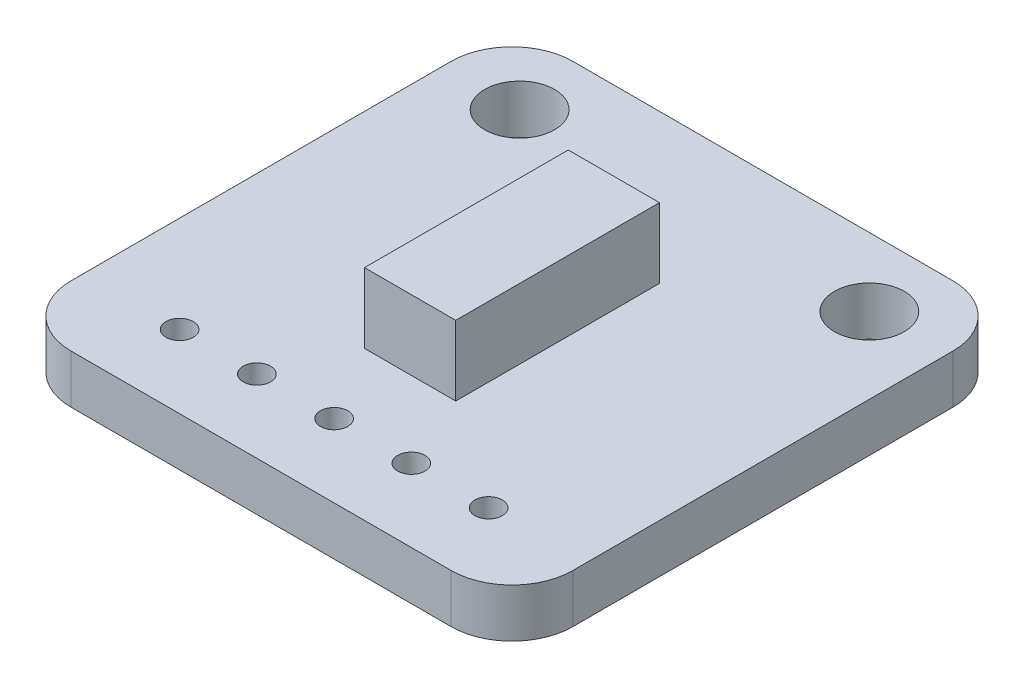
from build123d import *

# Parameters (mm, degrees)
SKETCH1_W           = 16.5
SKETCH1_H           = 16.5
SKETCH1_R           = 1.15
BOSS_EXTRUDE1_DEPTH = 1.6
SKETCH2_W           = 3
SKETCH2_H           = 6.7
BOSS_EXTRUDE2_DEPTH = 2.3
BOSS_EXTRUDE4_DEPTH = 0.3
LPATTERN1_COUNT     = 3
LPATTERN1_PITCH     = 2.54
LPATTERN1_2_COUNT   = 3
LPATTERN1_2_PITCH   = 2.54
SKETCH6_R           = 0.45
CUT_EXTRUDE1_DEPTH  = 18.878216494
FILLET1_R           = 2


with BuildPart() as part:
    # Sketch1 → Boss-Extrude1 (new body)
    with BuildSketch(Plane(origin=(0, 0, 0), x_dir=(1, 0, 0), z_dir=(0, 1, 0))):
        Rectangle(SKETCH1_W, SKETCH1_H)
        with Locations(Location((-5.75, 6, 0), (0, 0, 270))):
            Circle(SKETCH1_R, mode=Mode.SUBTRACT)
        with Locations(Location((5.75, 6, 0), (0, 0, 270))):
            Circle(SKETCH1_R, mode=Mode.SUBTRACT)
    extrude(amount=BOSS_EXTRUDE1_DEPTH)

    # Sketch2 → Boss-Extrude2 (add)
    with BuildSketch(Plane(origin=(0, 1.6, 0), x_dir=(1, 0, 0), z_dir=(0, 1, 0))):
        Rectangle(SKETCH2_W, SKETCH2_H)
    extrude(amount=BOSS_EXTRUDE2_DEPTH)

    # Sketch6 → Cut-Extrude1 (cut, through all)
    with BuildSketch(Plane(origin=(0, 1.6, 0), x_dir=(1, 0, 0), z_dir=(0, 1, 0))):
        with Locations(Location((-5.08, -5.85, 0), (0, 0, 270))):
            Circle(SKETCH6_R)
        with Locations(Location((-2.54, -5.85, 0), (0, 0, 270))):
            Circle(SKETCH6_R)
        with Locations(Location((0, -5.85, 0), (0, 0, 270))):
            Circle(SKETCH6_R)
        with Locations(Location((2.54, -5.85, 0), (0, 0, 270))):
            Circle(SKETCH6_R)
        with Locations(Location((5.08, -5.85, 0), (0, 0, 270))):
            Circle(SKETCH6_R)
    extrude(amount=-CUT_EXTRUDE1_DEPTH, mode=Mode.SUBTRACT)

    # Fillet1
    fillet1_edges = [part.edges().sort_by_distance(p)[0] for p in [
        (8.25, 0.8, 8.25),
        (-8.25, 0.8, 8.25),
        (-8.25, 0.8, -8.25),
        (8.25, 0.8, -8.25),
    ]]
    fillet(fillet1_edges, radius=FILLET1_R)


with BuildPart() as body_2:
    # Sketch4 → Boss-Extrude4 (new, symmetric)
    with BuildSketch(Plane(origin=(0, 0, 0), x_dir=(0, 0, -1), z_dir=(1, 0, 0))):
        with BuildLine():
            Line((-6.15, 0), (-6.15, -0.425))
            ThreePointArc((-6.15, -0.425), (-6.296446609, -0.778553391), (-6.65, -0.925))
            Line((-6.65, -0.925), (-15.55, -0.925))
            Line((-15.55, -0.925), (-15.55, -1.525))
            Line((-15.55, -1.525), (-6.65, -1.525))
            ThreePointArc((-6.65, -1.525), (-5.872182541, -1.202817459), (-5.55, -0.425))
            Line((-5.55, -0.425), (-5.55, 0))
            Line((-5.55, 0), (-6.15, 0))
        make_face()
    extrude(amount=BOSS_EXTRUDE4_DEPTH, both=True)


with BuildPart() as lpattern1_1:
    # LPattern1: pattern copy
    add(body_2.part.moved(Location(Vector(1, 0, 0) * (1 * LPATTERN1_PITCH))))


with BuildPart() as lpattern1_2:
    # LPattern1: pattern copy
    add(body_2.part.moved(Location(Vector(1, 0, 0) * (2 * LPATTERN1_PITCH))))


with BuildPart() as lpattern1_2_1:
    # LPattern1 2: pattern copy
    add(body_2.part.moved(Location(Vector(-1, 0, 0) * (1 * LPATTERN1_2_PITCH))))


with BuildPart() as lpattern1_2_2:
    # LPattern1 2: pattern copy
    add(body_2.part.moved(Location(Vector(-1, 0, 0) * (2 * LPATTERN1_2_PITCH))))


solid = part.part
